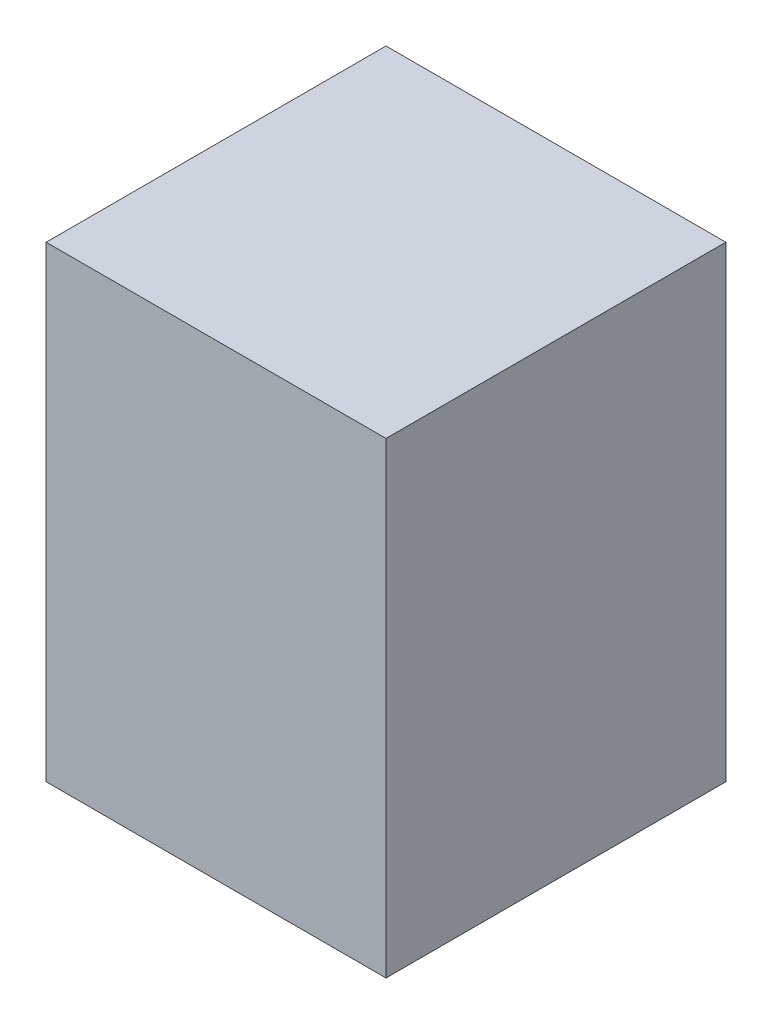
from build123d import *

# Parameters (mm, degrees)
SKETCH1_W           = 5.08
SKETCH1_H           = 6.985
BOSS_EXTRUDE1_DEPTH = 5.08


with BuildPart() as part:
    # Sketch1 → Boss-Extrude1 (new body)
    with BuildSketch(Plane(origin=(0, 0, 0), x_dir=(0, 0, -1), z_dir=(1, 0, 0))):
        with Locations((2.54, 3.4925)):
            Rectangle(SKETCH1_W, SKETCH1_H)
    extrude(amount=BOSS_EXTRUDE1_DEPTH)


solid = part.part
